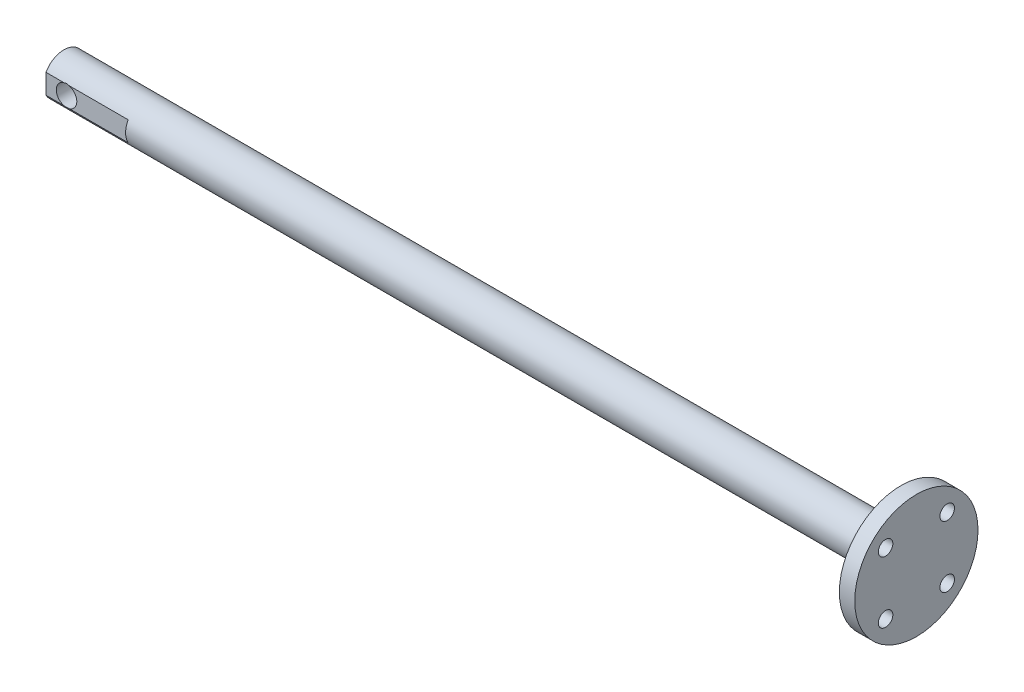
from build123d import *

# Parameters (mm, degrees)
SKETCH1_R                       = 19.05
BOSS_EXTRUDE1_DEPTH             = 263.525
SKETCH2_W                       = 258.7625
SKETCH2_H                       = 12.7
CUT_EXTRUDE1_DEPTH              = 265.898528922
CUT_EXTRUDE1_DEPTH_BACK         = 265.898528922
SKETCH8_W                       = 25.4
SKETCH8_H                       = 0.79375
F_1_1_DIAMETER_HOLE2_D          = 6.35
F_16_0_177_DIAMETER_HOLE1_D     = 4.4958
F_16_0_177_DIAMETER_HOLE1_DEPTH = 25.4
F_16_0_177_DIAMETER_HOLE1_TIP   = 1.350674586


with BuildPart() as part:
    # Sketch1 → Boss-Extrude1 (new body)
    with BuildSketch(Plane(origin=(0, 0, 0), x_dir=(0, 0, -1), z_dir=(1, 0, 0))):
        Circle(SKETCH1_R)
    extrude(amount=BOSS_EXTRUDE1_DEPTH)

    # Sketch2 → Cut-Revolve1 (revolve, cut)
    with BuildSketch(Plane.XY, mode=Mode.PRIVATE) as cut_revolve1_sk:
        with Locations((129.38125, 12.7)):
            Rectangle(SKETCH2_W, SKETCH2_H)
    revolve(cut_revolve1_sk.sketch.rotate(Axis((-16.52066387, 0, 0), (1, 0, 0)), 90), axis=Axis((-16.52066387, 0, 0), (1, 0, 0)), mode=Mode.SUBTRACT)

    # Sketch8 → Cut-Extrude1 (cut, two sides: drawn at the far end of the back side and taken through both)
    with BuildSketch(Plane(origin=(0, 0, 0), x_dir=(1, 0, 0), z_dir=(0, 1, 0)).offset(-CUT_EXTRUDE1_DEPTH_BACK)):
        with Locations((12.7, 5.953125)):
            Rectangle(SKETCH8_W, SKETCH8_H)
        with Locations((12.7, -5.953125)):
            Rectangle(SKETCH8_W, SKETCH8_H)
    extrude(amount=CUT_EXTRUDE1_DEPTH + CUT_EXTRUDE1_DEPTH_BACK, mode=Mode.SUBTRACT)

    # 1 (1) Diameter Hole2 (through all)
    with Locations(Plane(origin=(0, 0, -5.55625), x_dir=(-1, 0, 0), z_dir=(0, 0, -1))):
        with Locations((-6.35, 0)):
            Hole(F_1_1_DIAMETER_HOLE2_D / 2)

    # #16 (0.177) Diameter Hole1
    with Locations(Plane.ZY.offset(-258.7625)):
        with Locations((9.525, 9.525), (-9.525, -9.525), (-9.525, 9.525), (9.525, -9.525)):
            Hole(F_16_0_177_DIAMETER_HOLE1_D / 2, depth=F_16_0_177_DIAMETER_HOLE1_DEPTH)
            with Locations((0, 0, -(F_16_0_177_DIAMETER_HOLE1_DEPTH + F_16_0_177_DIAMETER_HOLE1_TIP / 2))):  # 118° drill point
                Cone(0, F_16_0_177_DIAMETER_HOLE1_D / 2, F_16_0_177_DIAMETER_HOLE1_TIP, mode=Mode.SUBTRACT)


solid = part.part
